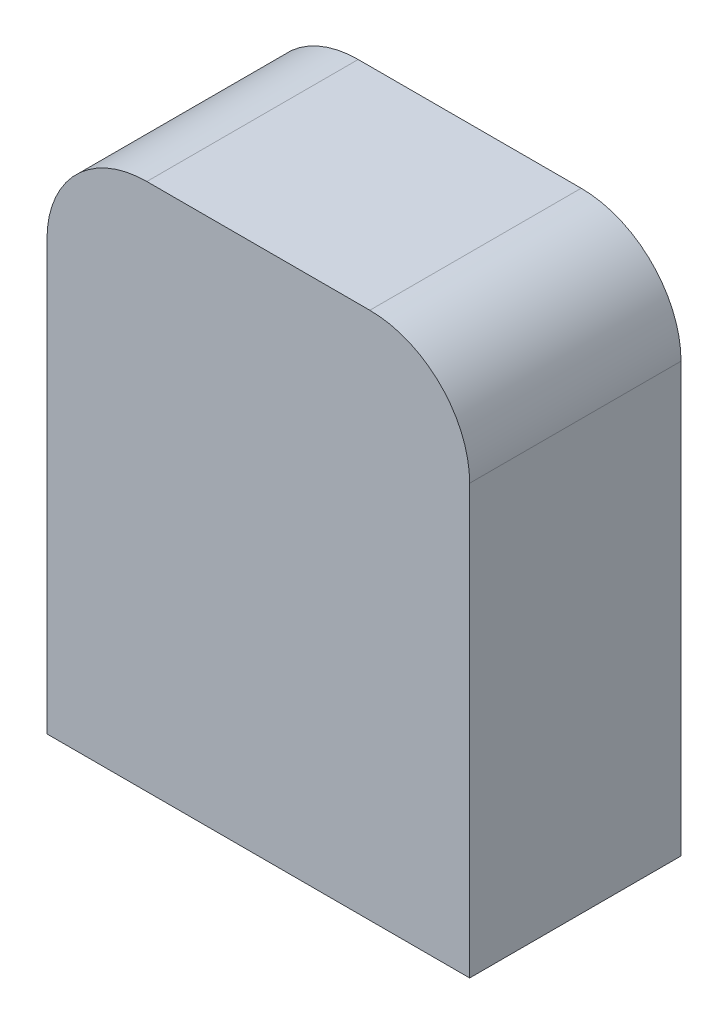
from build123d import *

# Parameters (mm, degrees)
SKETCH1_W           = 12.7
SKETCH1_H           = 15.875
BOSS_EXTRUDE1_DEPTH = 6.35
FILLET1_R           = 3


with BuildPart() as part:
    # Sketch1 → Boss-Extrude1 (new body)
    with BuildSketch(Plane.XY):
        with Locations((6.35, 7.9375)):
            Rectangle(SKETCH1_W, SKETCH1_H)
    extrude(amount=BOSS_EXTRUDE1_DEPTH)

    # Fillet1
    fillet1_edges = [part.edges().sort_by_distance(p)[0] for p in [
        (0, 15.875, 3.175),
        (12.7, 15.875, 3.175),
    ]]
    fillet(fillet1_edges, radius=FILLET1_R)


solid = part.part
